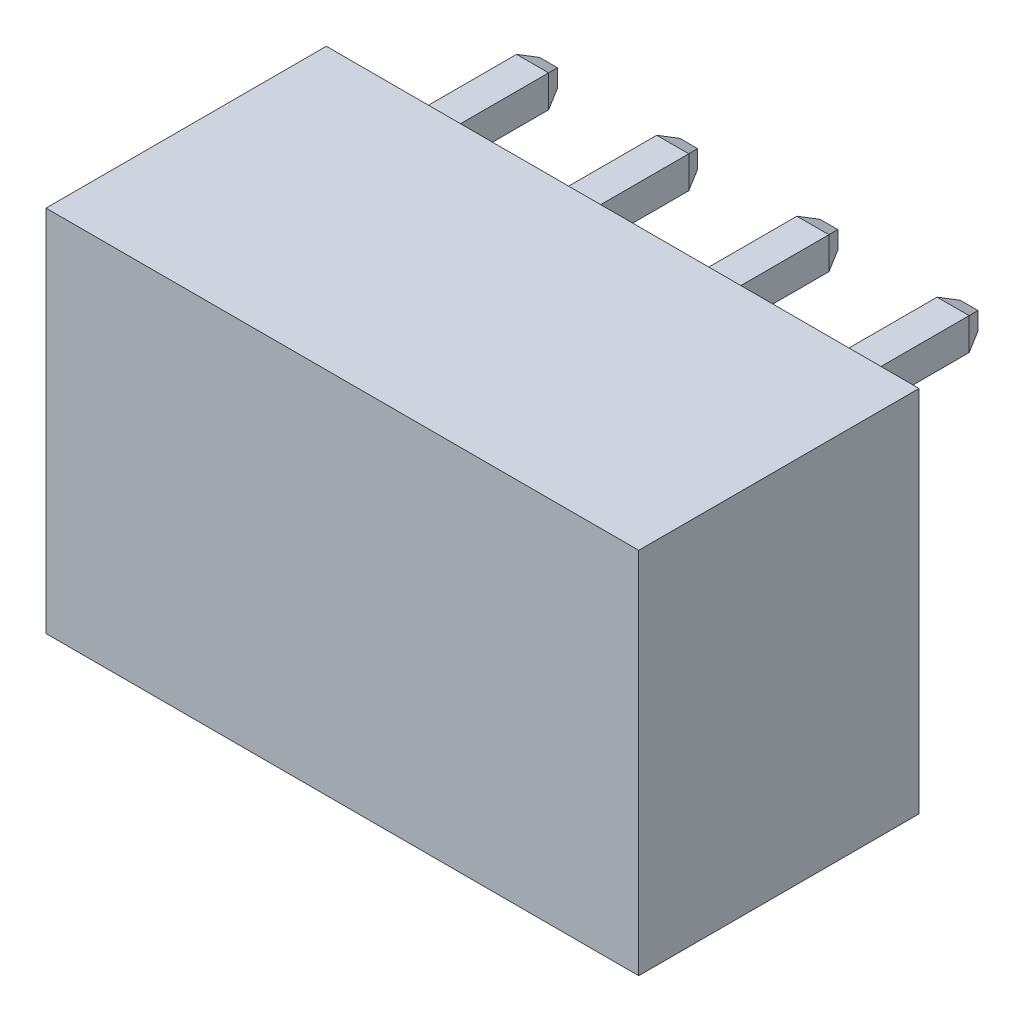
from build123d import *
from OCP.BRepFilletAPI import BRepFilletAPI_MakeChamfer

# Parameters (mm, degrees)
SKETCH_1_W                          = 14.8
SKETCH_1_H                          = 9.2
EXTRUDE_1_DEPTH                     = 7
SKETCH_2_W                          = 0.8
SKETCH_2_H                          = 0.8
EXTRUDE_2_DEPTH                     = 3.4
CHAMFER_1_SIZE                      = 0.4
CHAMFER_1_SIZE2                     = 0.178091474
CUT_EXTRUDE_1_DEPTH                 = 7
PATTERN_LINEAR_1_COUNT              = 4
PATTERN_LINEAR_1_PITCH              = 3.5
CHAMFER_1_OF_PATTERN_LINEAR_1_SIZE  = 0.4
CHAMFER_1_OF_PATTERN_LINEAR_1_SIZE2 = 0.178091474
PATTERN_LINEAR_2_COUNT              = 4
PATTERN_LINEAR_2_PITCH              = 3.5
SKETCH_4_W                          = 0.8
SKETCH_4_H                          = 0.8
EXTRUDE_3_DEPTH                     = 6
CHAMFER_2_SIZE                      = 0.4
CHAMFER_2_SIZE2                     = 0.178091474
PATTERN_LINEAR_3_COUNT              = 4
PATTERN_LINEAR_3_PITCH              = 3.5
CHAMFER_2_OF_PATTERN_LINEAR_3_SIZE  = 0.4
CHAMFER_2_OF_PATTERN_LINEAR_3_SIZE2 = 0.178091474


with BuildPart() as part:
    # Эскиз1 → Бобышка-Вытянуть1 (new body)
    with BuildSketch(Plane.XY):
        with Locations((0, 4.6)):
            Rectangle(SKETCH_1_W, SKETCH_1_H)
    extrude(amount=EXTRUDE_1_DEPTH)

    # Эскиз2 → Бобышка-Вытянуть2 (add)
    with BuildSketch(Plane(origin=(0, 0, 0), x_dir=(-1, 0, 0), z_dir=(0, 0, -1))):
        with Locations((-5.25, 8)):
            Rectangle(SKETCH_2_W, SKETCH_2_H)
    extrude_2 = extrude(amount=EXTRUDE_2_DEPTH)

    # Фаска1: one chamfer whose edges measure the first distance from different faces: ONE call of the kernel's chamfer builder (chamfer() names one face for all edges)
    chamfer_1_edges_1 = [part.edges().sort_by_distance(p)[0] for p in [
        (4.85, 8, -3.4),
    ]]
    chamfer_1_side_1 = [part.faces().sort_by_distance(p)[0] for p in [
        (4.85, 8, -1.7),
    ]]
    chamfer_1_edges_2 = [part.edges().sort_by_distance(p)[0] for p in [
        (5.25, 8.4, -3.4),
    ]]
    chamfer_1_side_2 = [part.faces().sort_by_distance(p)[0] for p in [
        (5.25, 8.4, -1.7),
    ]]
    chamfer_1_edges_3 = [part.edges().sort_by_distance(p)[0] for p in [
        (5.65, 8, -3.4),
    ]]
    chamfer_1_side_3 = [part.faces().sort_by_distance(p)[0] for p in [
        (5.65, 8, -1.7),
    ]]
    chamfer_1_edges_4 = [part.edges().sort_by_distance(p)[0] for p in [
        (5.25, 7.6, -3.4),
    ]]
    chamfer_1_side_4 = [part.faces().sort_by_distance(p)[0] for p in [
        (5.25, 7.6, -1.7),
    ]]
    chamfer_1 = BRepFilletAPI_MakeChamfer(part.part.solid().wrapped)
    for e in chamfer_1_edges_1:
        chamfer_1.Add(CHAMFER_1_SIZE, CHAMFER_1_SIZE2, e.wrapped, chamfer_1_side_1[0].wrapped)  # the first distance lies on this face
    for e in chamfer_1_edges_2:
        chamfer_1.Add(CHAMFER_1_SIZE, CHAMFER_1_SIZE2, e.wrapped, chamfer_1_side_2[0].wrapped)  # the first distance lies on this face
    for e in chamfer_1_edges_3:
        chamfer_1.Add(CHAMFER_1_SIZE, CHAMFER_1_SIZE2, e.wrapped, chamfer_1_side_3[0].wrapped)  # the first distance lies on this face
    for e in chamfer_1_edges_4:
        chamfer_1.Add(CHAMFER_1_SIZE, CHAMFER_1_SIZE2, e.wrapped, chamfer_1_side_4[0].wrapped)  # the first distance lies on this face
    add(Compound.cast(chamfer_1.Shape()), mode=Mode.REPLACE)

    # Эскиз3 → Вырез-Вытянуть1 (cut)
    with BuildSketch(Plane.XZ):
        Polygon((3.65, 0.8), (6.75, 0.8), (6.75, 5), (5.75, 5), (6.75, 6.5), (3.65, 6.5), (4.65, 5), (3.65, 5), align=None)
    cut_extrude_1 = extrude(amount=-CUT_EXTRUDE_1_DEPTH, mode=Mode.SUBTRACT)

    # Линейный массив1: Бобышка-Вытянуть2 ×4
    with Locations(*[(-i * PATTERN_LINEAR_1_PITCH, 0, 0) for i in range(1, PATTERN_LINEAR_1_COUNT)]):
        add(extrude_2)

    # Фаска1 of Линейный массив1: one chamfer whose edges measure the first distance from different faces: ONE call of the kernel's chamfer builder (chamfer() names one face for all edges)
    chamfer_1_of_pattern_linear_1_edges_1 = [part.edges().sort_by_distance(p)[0] for p in [
        (1.35, 8, -3.4),
    ]]
    chamfer_1_of_pattern_linear_1_side_1 = [part.faces().sort_by_distance(p)[0] for p in [
        (1.35, 8, -1.7),
    ]]
    chamfer_1_of_pattern_linear_1_edges_2 = [part.edges().sort_by_distance(p)[0] for p in [
        (1.75, 8.4, -3.4),
    ]]
    chamfer_1_of_pattern_linear_1_side_2 = [part.faces().sort_by_distance(p)[0] for p in [
        (1.75, 8.4, -1.7),
    ]]
    chamfer_1_of_pattern_linear_1_edges_3 = [part.edges().sort_by_distance(p)[0] for p in [
        (2.15, 8, -3.4),
    ]]
    chamfer_1_of_pattern_linear_1_side_3 = [part.faces().sort_by_distance(p)[0] for p in [
        (2.15, 8, -1.7),
    ]]
    chamfer_1_of_pattern_linear_1_edges_4 = [part.edges().sort_by_distance(p)[0] for p in [
        (1.75, 7.6, -3.4),
    ]]
    chamfer_1_of_pattern_linear_1_side_4 = [part.faces().sort_by_distance(p)[0] for p in [
        (1.75, 7.6, -1.7),
    ]]
    chamfer_1_of_pattern_linear_1_edges_5 = [part.edges().sort_by_distance(p)[0] for p in [
        (-2.15, 8, -3.4),
    ]]
    chamfer_1_of_pattern_linear_1_side_5 = [part.faces().sort_by_distance(p)[0] for p in [
        (-2.15, 8, -1.7),
    ]]
    chamfer_1_of_pattern_linear_1_edges_6 = [part.edges().sort_by_distance(p)[0] for p in [
        (-1.75, 8.4, -3.4),
    ]]
    chamfer_1_of_pattern_linear_1_side_6 = [part.faces().sort_by_distance(p)[0] for p in [
        (-1.75, 8.4, -1.7),
    ]]
    chamfer_1_of_pattern_linear_1_edges_7 = [part.edges().sort_by_distance(p)[0] for p in [
        (-1.35, 8, -3.4),
    ]]
    chamfer_1_of_pattern_linear_1_side_7 = [part.faces().sort_by_distance(p)[0] for p in [
        (-1.35, 8, -1.7),
    ]]
    chamfer_1_of_pattern_linear_1_edges_8 = [part.edges().sort_by_distance(p)[0] for p in [
        (-1.75, 7.6, -3.4),
    ]]
    chamfer_1_of_pattern_linear_1_side_8 = [part.faces().sort_by_distance(p)[0] for p in [
        (-1.75, 7.6, -1.7),
    ]]
    chamfer_1_of_pattern_linear_1_edges_9 = [part.edges().sort_by_distance(p)[0] for p in [
        (-5.65, 8, -3.4),
    ]]
    chamfer_1_of_pattern_linear_1_side_9 = [part.faces().sort_by_distance(p)[0] for p in [
        (-5.65, 8, -1.7),
    ]]
    chamfer_1_of_pattern_linear_1_edges_10 = [part.edges().sort_by_distance(p)[0] for p in [
        (-5.25, 8.4, -3.4),
    ]]
    chamfer_1_of_pattern_linear_1_side_10 = [part.faces().sort_by_distance(p)[0] for p in [
        (-5.25, 8.4, -1.7),
    ]]
    chamfer_1_of_pattern_linear_1_edges_11 = [part.edges().sort_by_distance(p)[0] for p in [
        (-4.85, 8, -3.4),
    ]]
    chamfer_1_of_pattern_linear_1_side_11 = [part.faces().sort_by_distance(p)[0] for p in [
        (-4.85, 8, -1.7),
    ]]
    chamfer_1_of_pattern_linear_1_edges_12 = [part.edges().sort_by_distance(p)[0] for p in [
        (-5.25, 7.6, -3.4),
    ]]
    chamfer_1_of_pattern_linear_1_side_12 = [part.faces().sort_by_distance(p)[0] for p in [
        (-5.25, 7.6, -1.7),
    ]]
    chamfer_1_of_pattern_linear_1 = BRepFilletAPI_MakeChamfer(part.part.solid().wrapped)
    for e in chamfer_1_of_pattern_linear_1_edges_1:
        chamfer_1_of_pattern_linear_1.Add(CHAMFER_1_OF_PATTERN_LINEAR_1_SIZE, CHAMFER_1_OF_PATTERN_LINEAR_1_SIZE2, e.wrapped, chamfer_1_of_pattern_linear_1_side_1[0].wrapped)  # the first distance lies on this face
    for e in chamfer_1_of_pattern_linear_1_edges_2:
        chamfer_1_of_pattern_linear_1.Add(CHAMFER_1_OF_PATTERN_LINEAR_1_SIZE, CHAMFER_1_OF_PATTERN_LINEAR_1_SIZE2, e.wrapped, chamfer_1_of_pattern_linear_1_side_2[0].wrapped)  # the first distance lies on this face
    for e in chamfer_1_of_pattern_linear_1_edges_3:
        chamfer_1_of_pattern_linear_1.Add(CHAMFER_1_OF_PATTERN_LINEAR_1_SIZE, CHAMFER_1_OF_PATTERN_LINEAR_1_SIZE2, e.wrapped, chamfer_1_of_pattern_linear_1_side_3[0].wrapped)  # the first distance lies on this face
    for e in chamfer_1_of_pattern_linear_1_edges_4:
        chamfer_1_of_pattern_linear_1.Add(CHAMFER_1_OF_PATTERN_LINEAR_1_SIZE, CHAMFER_1_OF_PATTERN_LINEAR_1_SIZE2, e.wrapped, chamfer_1_of_pattern_linear_1_side_4[0].wrapped)  # the first distance lies on this face
    for e in chamfer_1_of_pattern_linear_1_edges_5:
        chamfer_1_of_pattern_linear_1.Add(CHAMFER_1_OF_PATTERN_LINEAR_1_SIZE, CHAMFER_1_OF_PATTERN_LINEAR_1_SIZE2, e.wrapped, chamfer_1_of_pattern_linear_1_side_5[0].wrapped)  # the first distance lies on this face
    for e in chamfer_1_of_pattern_linear_1_edges_6:
        chamfer_1_of_pattern_linear_1.Add(CHAMFER_1_OF_PATTERN_LINEAR_1_SIZE, CHAMFER_1_OF_PATTERN_LINEAR_1_SIZE2, e.wrapped, chamfer_1_of_pattern_linear_1_side_6[0].wrapped)  # the first distance lies on this face
    for e in chamfer_1_of_pattern_linear_1_edges_7:
        chamfer_1_of_pattern_linear_1.Add(CHAMFER_1_OF_PATTERN_LINEAR_1_SIZE, CHAMFER_1_OF_PATTERN_LINEAR_1_SIZE2, e.wrapped, chamfer_1_of_pattern_linear_1_side_7[0].wrapped)  # the first distance lies on this face
    for e in chamfer_1_of_pattern_linear_1_edges_8:
        chamfer_1_of_pattern_linear_1.Add(CHAMFER_1_OF_PATTERN_LINEAR_1_SIZE, CHAMFER_1_OF_PATTERN_LINEAR_1_SIZE2, e.wrapped, chamfer_1_of_pattern_linear_1_side_8[0].wrapped)  # the first distance lies on this face
    for e in chamfer_1_of_pattern_linear_1_edges_9:
        chamfer_1_of_pattern_linear_1.Add(CHAMFER_1_OF_PATTERN_LINEAR_1_SIZE, CHAMFER_1_OF_PATTERN_LINEAR_1_SIZE2, e.wrapped, chamfer_1_of_pattern_linear_1_side_9[0].wrapped)  # the first distance lies on this face
    for e in chamfer_1_of_pattern_linear_1_edges_10:
        chamfer_1_of_pattern_linear_1.Add(CHAMFER_1_OF_PATTERN_LINEAR_1_SIZE, CHAMFER_1_OF_PATTERN_LINEAR_1_SIZE2, e.wrapped, chamfer_1_of_pattern_linear_1_side_10[0].wrapped)  # the first distance lies on this face
    for e in chamfer_1_of_pattern_linear_1_edges_11:
        chamfer_1_of_pattern_linear_1.Add(CHAMFER_1_OF_PATTERN_LINEAR_1_SIZE, CHAMFER_1_OF_PATTERN_LINEAR_1_SIZE2, e.wrapped, chamfer_1_of_pattern_linear_1_side_11[0].wrapped)  # the first distance lies on this face
    for e in chamfer_1_of_pattern_linear_1_edges_12:
        chamfer_1_of_pattern_linear_1.Add(CHAMFER_1_OF_PATTERN_LINEAR_1_SIZE, CHAMFER_1_OF_PATTERN_LINEAR_1_SIZE2, e.wrapped, chamfer_1_of_pattern_linear_1_side_12[0].wrapped)  # the first distance lies on this face
    add(Compound.cast(chamfer_1_of_pattern_linear_1.Shape()), mode=Mode.REPLACE)

    # Линейный массив2: Вырез-Вытянуть1 ×4
    with Locations(*[(-i * PATTERN_LINEAR_2_PITCH, 0, 0) for i in range(1, PATTERN_LINEAR_2_COUNT)]):
        add(cut_extrude_1, mode=Mode.SUBTRACT)

    # Эскиз4 → Бобышка-Вытянуть3 (add)
    with BuildSketch(Plane.XZ.offset(-7)):
        with Locations((5.25, 3)):
            Rectangle(SKETCH_4_W, SKETCH_4_H)
    extrude_3 = extrude(amount=EXTRUDE_3_DEPTH)

    # Фаска2: one chamfer whose edges measure the first distance from different faces: ONE call of the kernel's chamfer builder (chamfer() names one face for all edges)
    chamfer_2_edges_1 = [part.edges().sort_by_distance(p)[0] for p in [
        (5.65, 1, 3),
    ]]
    chamfer_2_side_1 = [part.faces().sort_by_distance(p)[0] for p in [
        (5.65, 4, 3),
    ]]
    chamfer_2_edges_2 = [part.edges().sort_by_distance(p)[0] for p in [
        (5.25, 1, 3.4),
    ]]
    chamfer_2_side_2 = [part.faces().sort_by_distance(p)[0] for p in [
        (5.25, 4, 3.4),
    ]]
    chamfer_2_edges_3 = [part.edges().sort_by_distance(p)[0] for p in [
        (4.85, 1, 3),
    ]]
    chamfer_2_side_3 = [part.faces().sort_by_distance(p)[0] for p in [
        (4.85, 4, 3),
    ]]
    chamfer_2_edges_4 = [part.edges().sort_by_distance(p)[0] for p in [
        (5.25, 1, 2.6),
    ]]
    chamfer_2_side_4 = [part.faces().sort_by_distance(p)[0] for p in [
        (5.25, 4, 2.6),
    ]]
    chamfer_2 = BRepFilletAPI_MakeChamfer(part.part.solid().wrapped)
    for e in chamfer_2_edges_1:
        chamfer_2.Add(CHAMFER_2_SIZE, CHAMFER_2_SIZE2, e.wrapped, chamfer_2_side_1[0].wrapped)  # the first distance lies on this face
    for e in chamfer_2_edges_2:
        chamfer_2.Add(CHAMFER_2_SIZE, CHAMFER_2_SIZE2, e.wrapped, chamfer_2_side_2[0].wrapped)  # the first distance lies on this face
    for e in chamfer_2_edges_3:
        chamfer_2.Add(CHAMFER_2_SIZE, CHAMFER_2_SIZE2, e.wrapped, chamfer_2_side_3[0].wrapped)  # the first distance lies on this face
    for e in chamfer_2_edges_4:
        chamfer_2.Add(CHAMFER_2_SIZE, CHAMFER_2_SIZE2, e.wrapped, chamfer_2_side_4[0].wrapped)  # the first distance lies on this face
    add(Compound.cast(chamfer_2.Shape()), mode=Mode.REPLACE)

    # Линейный массив3: Бобышка-Вытянуть3 ×4
    with Locations(*[(-i * PATTERN_LINEAR_3_PITCH, 0, 0) for i in range(1, PATTERN_LINEAR_3_COUNT)]):
        add(extrude_3)

    # Фаска2 of Линейный массив3: one chamfer whose edges measure the first distance from different faces: ONE call of the kernel's chamfer builder (chamfer() names one face for all edges)
    chamfer_2_of_pattern_linear_3_edges_1 = [part.edges().sort_by_distance(p)[0] for p in [
        (2.15, 1, 3),
    ]]
    chamfer_2_of_pattern_linear_3_side_1 = [part.faces().sort_by_distance(p)[0] for p in [
        (2.15, 4, 3),
    ]]
    chamfer_2_of_pattern_linear_3_edges_2 = [part.edges().sort_by_distance(p)[0] for p in [
        (1.75, 1, 3.4),
    ]]
    chamfer_2_of_pattern_linear_3_side_2 = [part.faces().sort_by_distance(p)[0] for p in [
        (1.75, 4, 3.4),
    ]]
    chamfer_2_of_pattern_linear_3_edges_3 = [part.edges().sort_by_distance(p)[0] for p in [
        (1.35, 1, 3),
    ]]
    chamfer_2_of_pattern_linear_3_side_3 = [part.faces().sort_by_distance(p)[0] for p in [
        (1.35, 4, 3),
    ]]
    chamfer_2_of_pattern_linear_3_edges_4 = [part.edges().sort_by_distance(p)[0] for p in [
        (1.75, 1, 2.6),
    ]]
    chamfer_2_of_pattern_linear_3_side_4 = [part.faces().sort_by_distance(p)[0] for p in [
        (1.75, 4, 2.6),
    ]]
    chamfer_2_of_pattern_linear_3_edges_5 = [part.edges().sort_by_distance(p)[0] for p in [
        (-1.35, 1, 3),
    ]]
    chamfer_2_of_pattern_linear_3_side_5 = [part.faces().sort_by_distance(p)[0] for p in [
        (-1.35, 4, 3),
    ]]
    chamfer_2_of_pattern_linear_3_edges_6 = [part.edges().sort_by_distance(p)[0] for p in [
        (-1.75, 1, 3.4),
    ]]
    chamfer_2_of_pattern_linear_3_side_6 = [part.faces().sort_by_distance(p)[0] for p in [
        (-1.75, 4, 3.4),
    ]]
    chamfer_2_of_pattern_linear_3_edges_7 = [part.edges().sort_by_distance(p)[0] for p in [
        (-2.15, 1, 3),
    ]]
    chamfer_2_of_pattern_linear_3_side_7 = [part.faces().sort_by_distance(p)[0] for p in [
        (-2.15, 4, 3),
    ]]
    chamfer_2_of_pattern_linear_3_edges_8 = [part.edges().sort_by_distance(p)[0] for p in [
        (-1.75, 1, 2.6),
    ]]
    chamfer_2_of_pattern_linear_3_side_8 = [part.faces().sort_by_distance(p)[0] for p in [
        (-1.75, 4, 2.6),
    ]]
    chamfer_2_of_pattern_linear_3_edges_9 = [part.edges().sort_by_distance(p)[0] for p in [
        (-4.85, 1, 3),
    ]]
    chamfer_2_of_pattern_linear_3_side_9 = [part.faces().sort_by_distance(p)[0] for p in [
        (-4.85, 4, 3),
    ]]
    chamfer_2_of_pattern_linear_3_edges_10 = [part.edges().sort_by_distance(p)[0] for p in [
        (-5.25, 1, 3.4),
    ]]
    chamfer_2_of_pattern_linear_3_side_10 = [part.faces().sort_by_distance(p)[0] for p in [
        (-5.25, 4, 3.4),
    ]]
    chamfer_2_of_pattern_linear_3_edges_11 = [part.edges().sort_by_distance(p)[0] for p in [
        (-5.65, 1, 3),
    ]]
    chamfer_2_of_pattern_linear_3_side_11 = [part.faces().sort_by_distance(p)[0] for p in [
        (-5.65, 4, 3),
    ]]
    chamfer_2_of_pattern_linear_3_edges_12 = [part.edges().sort_by_distance(p)[0] for p in [
        (-5.25, 1, 2.6),
    ]]
    chamfer_2_of_pattern_linear_3_side_12 = [part.faces().sort_by_distance(p)[0] for p in [
        (-5.25, 4, 2.6),
    ]]
    chamfer_2_of_pattern_linear_3 = BRepFilletAPI_MakeChamfer(part.part.solid().wrapped)
    for e in chamfer_2_of_pattern_linear_3_edges_1:
        chamfer_2_of_pattern_linear_3.Add(CHAMFER_2_OF_PATTERN_LINEAR_3_SIZE, CHAMFER_2_OF_PATTERN_LINEAR_3_SIZE2, e.wrapped, chamfer_2_of_pattern_linear_3_side_1[0].wrapped)  # the first distance lies on this face
    for e in chamfer_2_of_pattern_linear_3_edges_2:
        chamfer_2_of_pattern_linear_3.Add(CHAMFER_2_OF_PATTERN_LINEAR_3_SIZE, CHAMFER_2_OF_PATTERN_LINEAR_3_SIZE2, e.wrapped, chamfer_2_of_pattern_linear_3_side_2[0].wrapped)  # the first distance lies on this face
    for e in chamfer_2_of_pattern_linear_3_edges_3:
        chamfer_2_of_pattern_linear_3.Add(CHAMFER_2_OF_PATTERN_LINEAR_3_SIZE, CHAMFER_2_OF_PATTERN_LINEAR_3_SIZE2, e.wrapped, chamfer_2_of_pattern_linear_3_side_3[0].wrapped)  # the first distance lies on this face
    for e in chamfer_2_of_pattern_linear_3_edges_4:
        chamfer_2_of_pattern_linear_3.Add(CHAMFER_2_OF_PATTERN_LINEAR_3_SIZE, CHAMFER_2_OF_PATTERN_LINEAR_3_SIZE2, e.wrapped, chamfer_2_of_pattern_linear_3_side_4[0].wrapped)  # the first distance lies on this face
    for e in chamfer_2_of_pattern_linear_3_edges_5:
        chamfer_2_of_pattern_linear_3.Add(CHAMFER_2_OF_PATTERN_LINEAR_3_SIZE, CHAMFER_2_OF_PATTERN_LINEAR_3_SIZE2, e.wrapped, chamfer_2_of_pattern_linear_3_side_5[0].wrapped)  # the first distance lies on this face
    for e in chamfer_2_of_pattern_linear_3_edges_6:
        chamfer_2_of_pattern_linear_3.Add(CHAMFER_2_OF_PATTERN_LINEAR_3_SIZE, CHAMFER_2_OF_PATTERN_LINEAR_3_SIZE2, e.wrapped, chamfer_2_of_pattern_linear_3_side_6[0].wrapped)  # the first distance lies on this face
    for e in chamfer_2_of_pattern_linear_3_edges_7:
        chamfer_2_of_pattern_linear_3.Add(CHAMFER_2_OF_PATTERN_LINEAR_3_SIZE, CHAMFER_2_OF_PATTERN_LINEAR_3_SIZE2, e.wrapped, chamfer_2_of_pattern_linear_3_side_7[0].wrapped)  # the first distance lies on this face
    for e in chamfer_2_of_pattern_linear_3_edges_8:
        chamfer_2_of_pattern_linear_3.Add(CHAMFER_2_OF_PATTERN_LINEAR_3_SIZE, CHAMFER_2_OF_PATTERN_LINEAR_3_SIZE2, e.wrapped, chamfer_2_of_pattern_linear_3_side_8[0].wrapped)  # the first distance lies on this face
    for e in chamfer_2_of_pattern_linear_3_edges_9:
        chamfer_2_of_pattern_linear_3.Add(CHAMFER_2_OF_PATTERN_LINEAR_3_SIZE, CHAMFER_2_OF_PATTERN_LINEAR_3_SIZE2, e.wrapped, chamfer_2_of_pattern_linear_3_side_9[0].wrapped)  # the first distance lies on this face
    for e in chamfer_2_of_pattern_linear_3_edges_10:
        chamfer_2_of_pattern_linear_3.Add(CHAMFER_2_OF_PATTERN_LINEAR_3_SIZE, CHAMFER_2_OF_PATTERN_LINEAR_3_SIZE2, e.wrapped, chamfer_2_of_pattern_linear_3_side_10[0].wrapped)  # the first distance lies on this face
    for e in chamfer_2_of_pattern_linear_3_edges_11:
        chamfer_2_of_pattern_linear_3.Add(CHAMFER_2_OF_PATTERN_LINEAR_3_SIZE, CHAMFER_2_OF_PATTERN_LINEAR_3_SIZE2, e.wrapped, chamfer_2_of_pattern_linear_3_side_11[0].wrapped)  # the first distance lies on this face
    for e in chamfer_2_of_pattern_linear_3_edges_12:
        chamfer_2_of_pattern_linear_3.Add(CHAMFER_2_OF_PATTERN_LINEAR_3_SIZE, CHAMFER_2_OF_PATTERN_LINEAR_3_SIZE2, e.wrapped, chamfer_2_of_pattern_linear_3_side_12[0].wrapped)  # the first distance lies on this face
    add(Compound.cast(chamfer_2_of_pattern_linear_3.Shape()), mode=Mode.REPLACE)


solid = part.part
